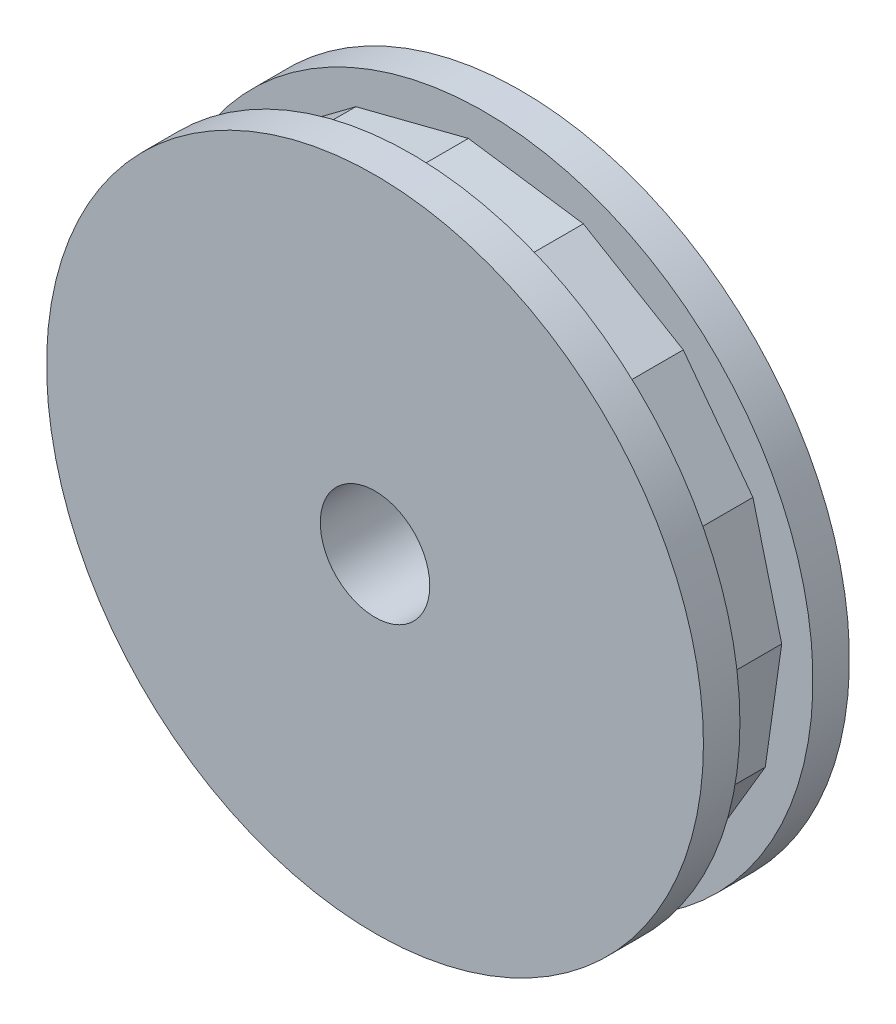
from build123d import *

# Parameters (mm, degrees)
EXTRUDE_1_DEPTH     = 2
SKETCH_2_R          = 9
EXTRUDE_2_DEPTH     = 1
EXTRUDE_START       = 1
SKETCH_3_R          = 9
EXTRUDE_3_DEPTH     = 1
SKETCH_4_R          = 1.5
CUT_EXTRUDE_1_DEPTH = 14.341664064


with BuildPart() as part:
    # Эскиз1 → Бобышка-Вытянуть1 (new body)
    with BuildSketch(Plane.XY):
        Polygon((8.144765867, 0.441612145), (7.35578483, 3.52486338), (5.446952233, 6.071486118), (2.708870535, 7.693780133), (-0.441612145, 8.144765867), (-3.52486338, 7.35578483), (-6.071486118, 5.446952233), (-7.693780133, 2.708870535), (-8.144765867, -0.441612145), (-7.35578483, -3.52486338), (-5.446952233, -6.071486118), (-2.708870535, -7.693780133), (0.441612145, -8.144765867), (3.52486338, -7.35578483), (6.071486118, -5.446952233), (7.693780133, -2.708870535), align=None)
    extrude(amount=EXTRUDE_1_DEPTH)

    # Эскиз2 → Бобышка-Вытянуть2 (add)
    with BuildSketch(Plane(origin=(0, 0, 0), x_dir=(-1, 0, 0), z_dir=(0, 0, -1))):
        Circle(SKETCH_2_R)
    extrude(amount=EXTRUDE_2_DEPTH)

    # Эскиз3 → Бобышка-Вытянуть3 (add)
    with BuildSketch(Plane.XY.offset(2).offset(EXTRUDE_START)):
        with Locations(Location((0, 0, 0), (0, 0, 180))):
            Circle(SKETCH_3_R)
    extrude(amount=-EXTRUDE_3_DEPTH)

    # Эскиз4 → Вырез-Вытянуть1 (cut, through all)
    with BuildSketch(Plane.XY.offset(3)):
        Circle(SKETCH_4_R)
    extrude(amount=-CUT_EXTRUDE_1_DEPTH, mode=Mode.SUBTRACT)


solid = part.part
